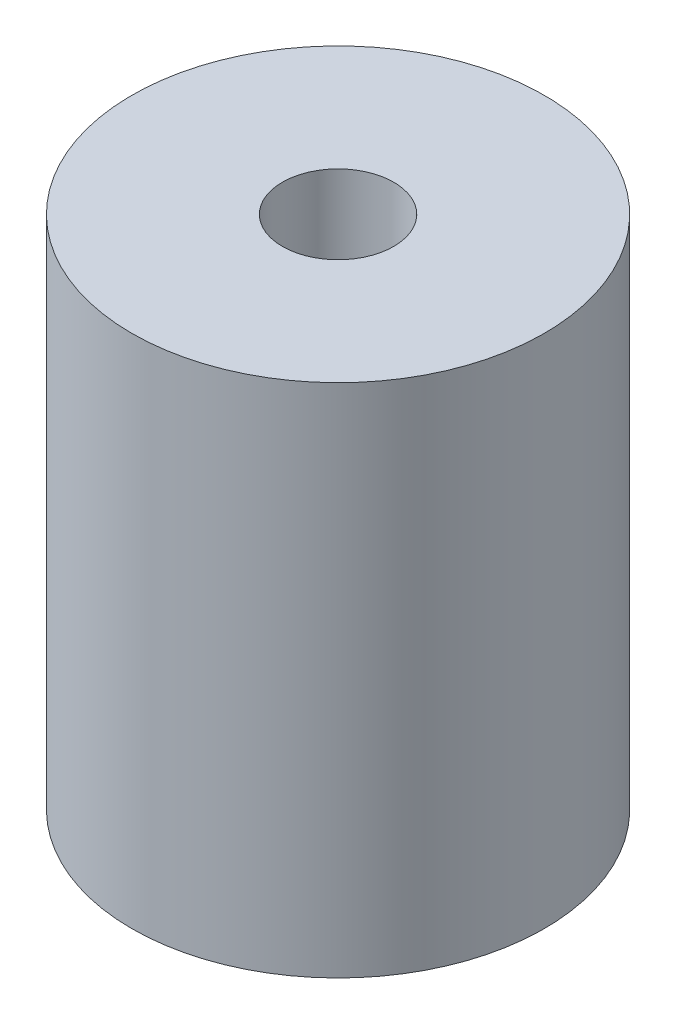
from build123d import *

# Parameters (mm, degrees)
SKETCH1_R           = 10
BOSS_EXTRUDE1_DEPTH = 12.5
SKETCH2_R           = 2.7
CUT_EXTRUDE1_DEPTH  = 12.5
SKETCH3_R           = 4.2
CUT_EXTRUDE2_DEPTH  = 12.5


with BuildPart() as part:
    # Sketch1 → Boss-Extrude1 (new, symmetric)
    with BuildSketch(Plane(origin=(0, 0, 0), x_dir=(1, 0, 0), z_dir=(0, 1, 0))):
        with Locations(Location((0, 0, 0), (0, 0, 270))):
            Circle(SKETCH1_R)
    extrude(amount=BOSS_EXTRUDE1_DEPTH, both=True)

    # Sketch2 → Cut-Extrude1 (cut)
    with BuildSketch(Plane(origin=(0, 0, 0), x_dir=(1, 0, 0), z_dir=(0, 1, 0))):
        with Locations(Location((0, 0, 0), (0, 0, 270))):
            Circle(SKETCH2_R)
    extrude(amount=CUT_EXTRUDE1_DEPTH, mode=Mode.SUBTRACT)

    # Sketch3 → Cut-Extrude2 (cut)
    with BuildSketch(Plane(origin=(0, 0, 0), x_dir=(1, 0, 0), z_dir=(0, 1, 0))):
        with Locations(Location((0, 0, 0), (0, 0, 270))):
            Circle(SKETCH3_R)
    extrude(amount=-CUT_EXTRUDE2_DEPTH, mode=Mode.SUBTRACT)


solid = part.part
